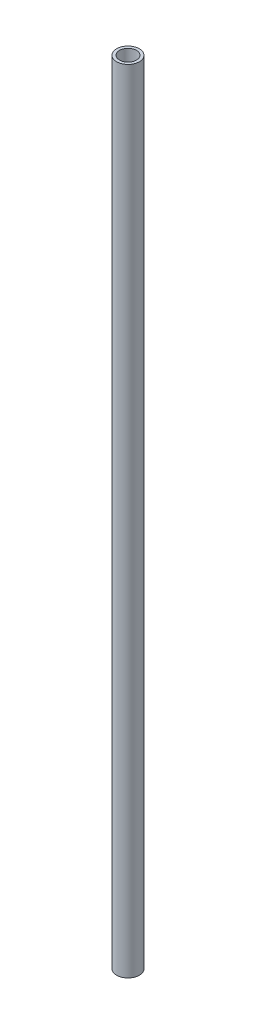
from build123d import *

# Parameters (mm, degrees)
SKETCH1_R           = 4
SKETCH1_R_2         = 3
BOSS_EXTRUDE1_DEPTH = 280


with BuildPart() as part:
    # Sketch1 → Boss-Extrude1 (new body)
    with BuildSketch(Plane(origin=(0, 0, 0), x_dir=(1, 0, 0), z_dir=(0, 1, 0))):
        with Locations(Location((0, 0, 0), (0, 0, 270))):
            Circle(SKETCH1_R)
        with Locations(Location((0, 0, 0), (0, 0, 270))):
            Circle(SKETCH1_R_2, mode=Mode.SUBTRACT)
    extrude(amount=BOSS_EXTRUDE1_DEPTH)


solid = part.part
